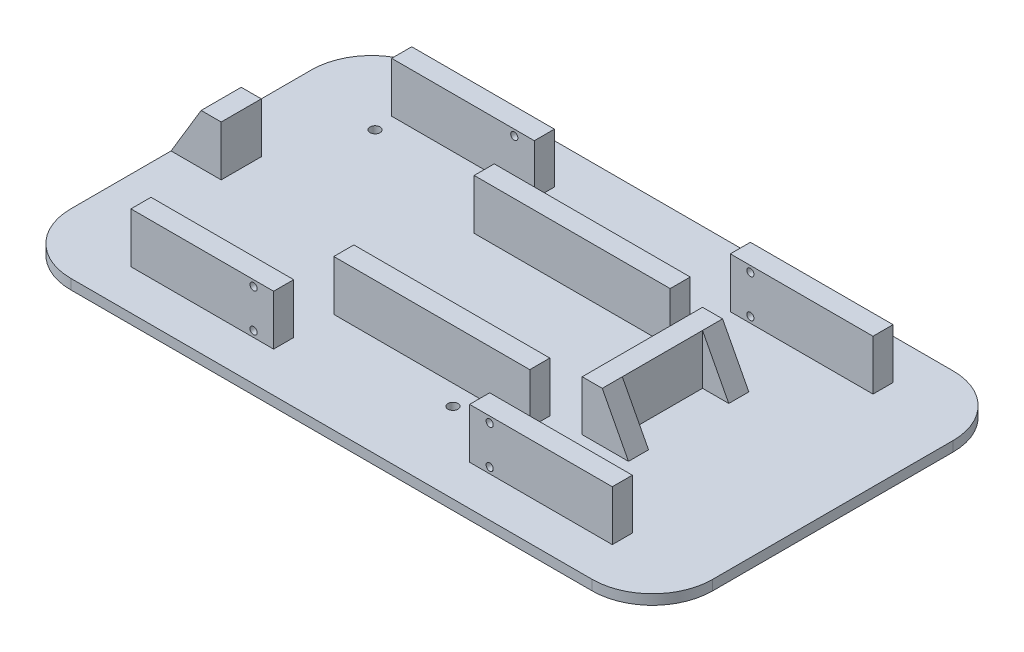
from build123d import *

# Parameters (mm, degrees)
BOSS_EXTRUDE1_DEPTH = 5
SKETCH2_W           = 71.143127042
SKETCH2_H           = 10
BOSS_EXTRUDE3_DEPTH = 25
SKETCH3_W           = 10
SKETCH3_H           = 10
BOSS_EXTRUDE4_DEPTH = 25
BOSS_EXTRUDE5_DEPTH = 10
SKETCH6_W           = 10
SKETCH6_H           = 60
BOSS_EXTRUDE6_DEPTH = 25
BOSS_EXTRUDE7_DEPTH = 10
SKETCH9_W           = 97.713745916
SKETCH9_H           = 10
BOSS_EXTRUDE8_DEPTH = 25
SKETCH11_R          = 2.5
CUT_EXTRUDE1_DEPTH  = 5
SKETCH12_R          = 1.788924299
CUT_EXTRUDE2_DEPTH  = 10


with BuildPart() as part:
    # Sketch1 → Boss-Extrude1 (new body)
    with BuildSketch(Plane(origin=(0, 0, 0), x_dir=(1, 0, 0), z_dir=(0, 1, 0))):
        with BuildLine():
            Line((-130, 90), (130, 90))
            ThreePointArc((130, 90), (151.213203436, 81.213203436), (160, 60))
            Line((160, 60), (160, -60))
            ThreePointArc((160, -60), (151.213203436, -81.213203436), (130, -90))
            Line((130, -90), (-130, -90))
            ThreePointArc((-130, -90), (-151.213203436, -81.213203436), (-160, -60))
            Line((-160, -60), (-160, 60))
            ThreePointArc((-160, 60), (-151.213203436, 81.213203436), (-130, 90))
        make_face()
    extrude(amount=BOSS_EXTRUDE1_DEPTH)

    # Sketch2 → Boss-Extrude3 (add)
    with BuildSketch(Plane(origin=(0, 5, 0), x_dir=(1, 0, 0), z_dir=(0, 1, 0))):
        with Locations((-84.428436479, 65)):
            Rectangle(SKETCH2_W, SKETCH2_H)
        with Locations((84.428436479, 65)):
            Rectangle(SKETCH2_W, SKETCH2_H)
        with Locations((84.428436479, -65)):
            Rectangle(SKETCH2_W, SKETCH2_H)
        with Locations((-84.428436479, -65)):
            Rectangle(SKETCH2_W, SKETCH2_H)
    extrude(amount=BOSS_EXTRUDE3_DEPTH)

    # Sketch3 → Boss-Extrude4 (add)
    with BuildSketch(Plane(origin=(0, 5, 0), x_dir=(1, 0, 0), z_dir=(0, 1, 0))):
        with Locations((-140, -5)):
            Rectangle(SKETCH3_W, SKETCH3_H)
    boss_extrude4 = extrude(amount=BOSS_EXTRUDE4_DEPTH)

    # Sketch5 → Boss-Extrude5 (add)
    with BuildSketch(Plane(origin=(0, 0, 0), x_dir=(-1, 0, 0), z_dir=(0, 0, -1))):
        Polygon((145, 5), (145, 30), (160, 5), align=None)
    boss_extrude5 = extrude(amount=-BOSS_EXTRUDE5_DEPTH)

    # Sketch6 → Boss-Extrude6 (add)
    with BuildSketch(Plane(origin=(0, 5, 0), x_dir=(1, 0, 0), z_dir=(0, 1, 0))):
        with Locations((70, 0)):
            Rectangle(SKETCH6_W, SKETCH6_H)
    extrude(amount=BOSS_EXTRUDE6_DEPTH)

    # Sketch8 → Boss-Extrude7 (add)
    with BuildSketch(Plane.XY.offset(30)):
        Polygon((75, 30), (88.085238775, 5), (75, 5), align=None)
    boss_extrude7 = extrude(amount=-BOSS_EXTRUDE7_DEPTH)

    # Mirror1: Boss-Extrude7 across plane
    add(boss_extrude7.mirror(Plane(origin=(0, 0, 0), x_dir=(1, 0, 0), z_dir=(0, 0, -1))))

    # Mirror2: Boss-Extrude4, Boss-Extrude5 across plane
    add(boss_extrude4.mirror(Plane(origin=(-145, 30, 0), x_dir=(1, 0, 0), z_dir=(0, 0, 1))))
    add(boss_extrude5.mirror(Plane(origin=(-145, 30, 0), x_dir=(1, 0, 0), z_dir=(0, 0, 1))))

    # Sketch9 → Boss-Extrude8 (add)
    with BuildSketch(Plane(origin=(0, 5, 0), x_dir=(1, 0, 0), z_dir=(0, 1, 0))):
        with Locations((0, -35)):
            Rectangle(SKETCH9_W, SKETCH9_H)
    boss_extrude8 = extrude(amount=BOSS_EXTRUDE8_DEPTH)

    # Mirror3: Boss-Extrude8 across plane
    add(boss_extrude8.mirror(Plane(origin=(0, 0, 0), x_dir=(1, 0, 0), z_dir=(0, 0, -1))))

    # Sketch11 → Cut-Extrude1 (cut)
    with BuildSketch(Plane(origin=(0, 5, 0), x_dir=(1, 0, 0), z_dir=(0, 1, 0))):
        with Locations(Location((-118.275690488, 50, 0), (0, 0, 270))):
            Circle(SKETCH11_R)
        with Locations(Location((-118.275690488, -50, 0), (0, 0, 270))):
            Circle(SKETCH11_R)
        with Locations(Location((20.561944572, -50, 0), (0, 0, 270))):
            Circle(SKETCH11_R)
        with Locations(Location((20.561944572, 50, 0), (0, 0, 270))):
            Circle(SKETCH11_R)
    extrude(amount=-CUT_EXTRUDE1_DEPTH, mode=Mode.SUBTRACT)

    # Sketch12 → Cut-Extrude2 (cut)
    with BuildSketch(Plane.XY.offset(70)):
        with Locations((-58.856872958, 27)):
            Circle(SKETCH12_R)
        with Locations(Location((-58.856872958, 8, 0), (0, 0, 180))):
            Circle(SKETCH12_R)
        with Locations((58.856872958, 8)):
            Circle(SKETCH12_R)
        with Locations(Location((58.856872958, 27, 0), (0, 0, 180))):
            Circle(SKETCH12_R)
    cut_extrude2 = extrude(amount=-CUT_EXTRUDE2_DEPTH, mode=Mode.SUBTRACT)

    # Mirror4: Cut-Extrude2 across plane
    add(cut_extrude2.mirror(Plane.XY), mode=Mode.SUBTRACT)


solid = part.part
